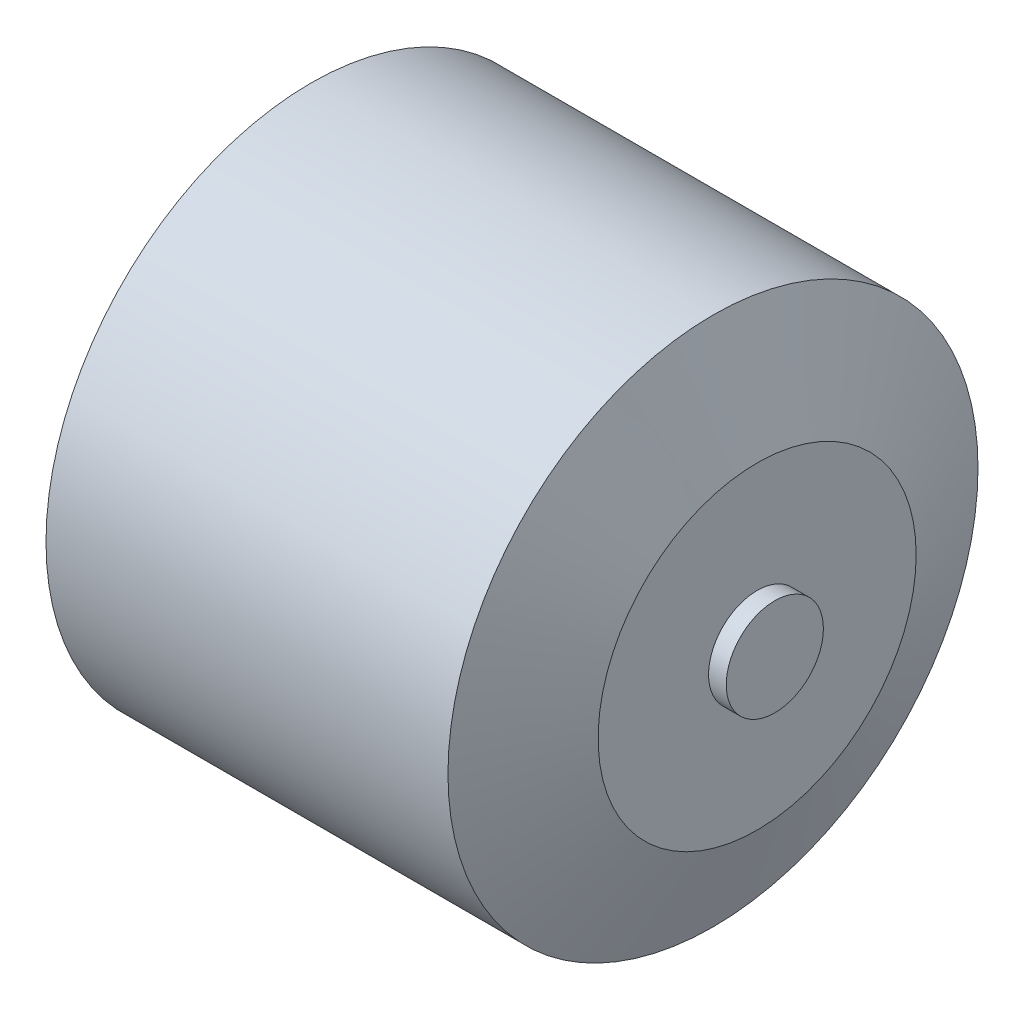
from build123d import *

# Parameters (mm, degrees)
BOSS_EXTRUDE1_START = 4
SKETCH1_R           = 60
BOSS_EXTRUDE1_DEPTH = 91
SKETCH3_R           = 47.5
SKETCH3_R_2         = 2.25
BOSS_EXTRUDE2_DEPTH = 4
SKETCH4_R           = 6
BOSS_EXTRUDE3_DEPTH = 20
CUT_EXTRUDE1_START  = -15
CUT_EXTRUDE1_DEPTH  = 15


with BuildPart() as part:
    # Sketch1 → Boss-Extrude1 (new body)
    with BuildSketch(Plane(origin=(0, 0, 0), x_dir=(0, 0, -1), z_dir=(1, 0, 0)).offset(BOSS_EXTRUDE1_START)):
        Circle(SKETCH1_R)
    extrude(amount=BOSS_EXTRUDE1_DEPTH)

    # Sketch2 → Revolve1 (revolve)
    with BuildSketch(Plane.XY):
        Polygon((95, 60), (105, 36), (105, 11), (109, 11), (109, 0), (105, 0), (95, 0), align=None)
    revolve(axis=Axis((95, 0, 0), (-1, 0, 0)))

    # Sketch3 → Boss-Extrude2 (add)
    with BuildSketch(Plane.ZY.offset(-4)):
        Circle(SKETCH3_R)
        with Locations((21.213203436, -21.213203436)):
            Circle(SKETCH3_R_2, mode=Mode.SUBTRACT)
        with Locations((-21.213203436, -21.213203436)):
            Circle(SKETCH3_R_2, mode=Mode.SUBTRACT)
        with Locations((-28.977774789, -7.764571353)):
            Circle(SKETCH3_R_2, mode=Mode.SUBTRACT)
        with Locations((-28.977774789, 7.764571353)):
            Circle(SKETCH3_R_2, mode=Mode.SUBTRACT)
        with Locations((-21.213203436, 21.213203436)):
            Circle(SKETCH3_R_2, mode=Mode.SUBTRACT)
        with Locations((-7.764571353, 28.977774789)):
            Circle(SKETCH3_R_2, mode=Mode.SUBTRACT)
        with Locations((7.764571353, 28.977774789)):
            Circle(SKETCH3_R_2, mode=Mode.SUBTRACT)
        with Locations((21.213203436, 21.213203436)):
            Circle(SKETCH3_R_2, mode=Mode.SUBTRACT)
        with Locations((28.977774789, 7.764571353)):
            Circle(SKETCH3_R_2, mode=Mode.SUBTRACT)
        with Locations((28.977774789, -7.764571353)):
            Circle(SKETCH3_R_2, mode=Mode.SUBTRACT)
    extrude(amount=BOSS_EXTRUDE2_DEPTH)

    # Sketch4 → Boss-Extrude3 (add)
    with BuildSketch(Plane.ZY):
        Circle(SKETCH4_R)
    extrude(amount=BOSS_EXTRUDE3_DEPTH)

    # Sketch5 → Cut-Extrude1 (cut)
    with BuildSketch(Plane.ZY.offset(20).offset(CUT_EXTRUDE1_START)):
        with BuildLine():
            Line((5.656854249, 2), (4, 2))
            Line((4, 2), (4, -2))
            Line((4, -2), (5.656854249, -2))
            ThreePointArc((5.656854249, -2), (6, 0), (5.656854249, 2))
        make_face()
    extrude(amount=CUT_EXTRUDE1_DEPTH, mode=Mode.SUBTRACT)


solid = part.part
